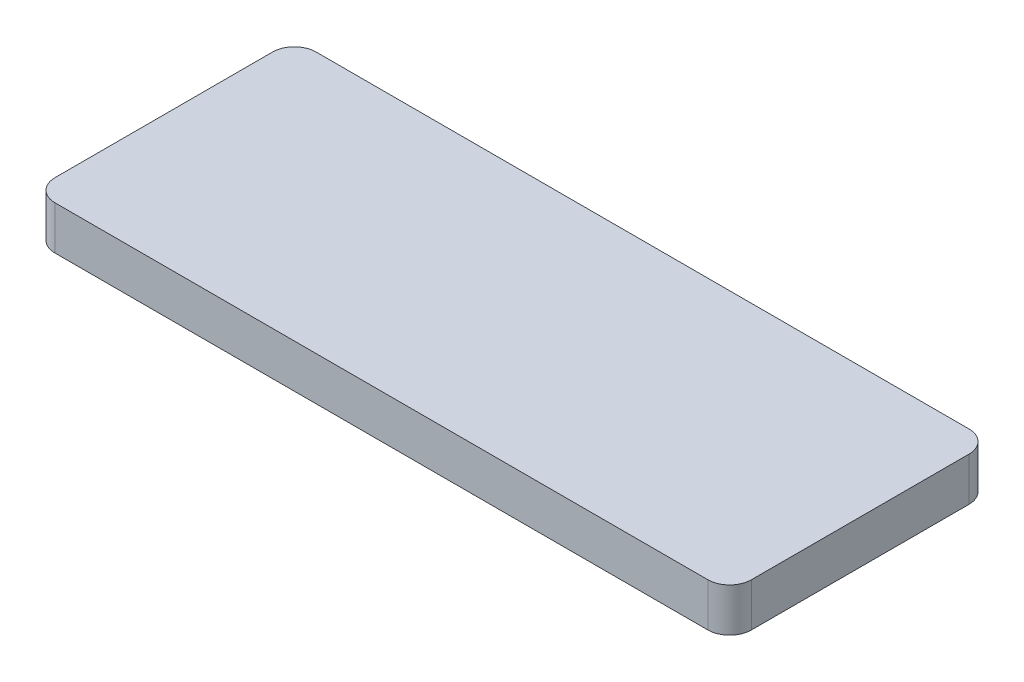
from build123d import *

# Parameters (mm, degrees)
SKETCH1_W           = 160
SKETCH1_H           = 60
BOSS_EXTRUDE1_DEPTH = 10
FILLET1_R           = 5


with BuildPart() as part:
    # Sketch1 → Boss-Extrude1 (new body)
    with BuildSketch(Plane(origin=(0, 0, 0), x_dir=(1, 0, 0), z_dir=(0, 1, 0))):
        Rectangle(SKETCH1_W, SKETCH1_H)
    extrude(amount=BOSS_EXTRUDE1_DEPTH)

    # Fillet1
    fillet1_edges = [part.edges().sort_by_distance(p)[0] for p in [
        (80, 5, 30),
        (-80, 5, 30),
        (-80, 5, -30),
        (80, 5, -30),
    ]]
    fillet(fillet1_edges, radius=FILLET1_R)


solid = part.part
